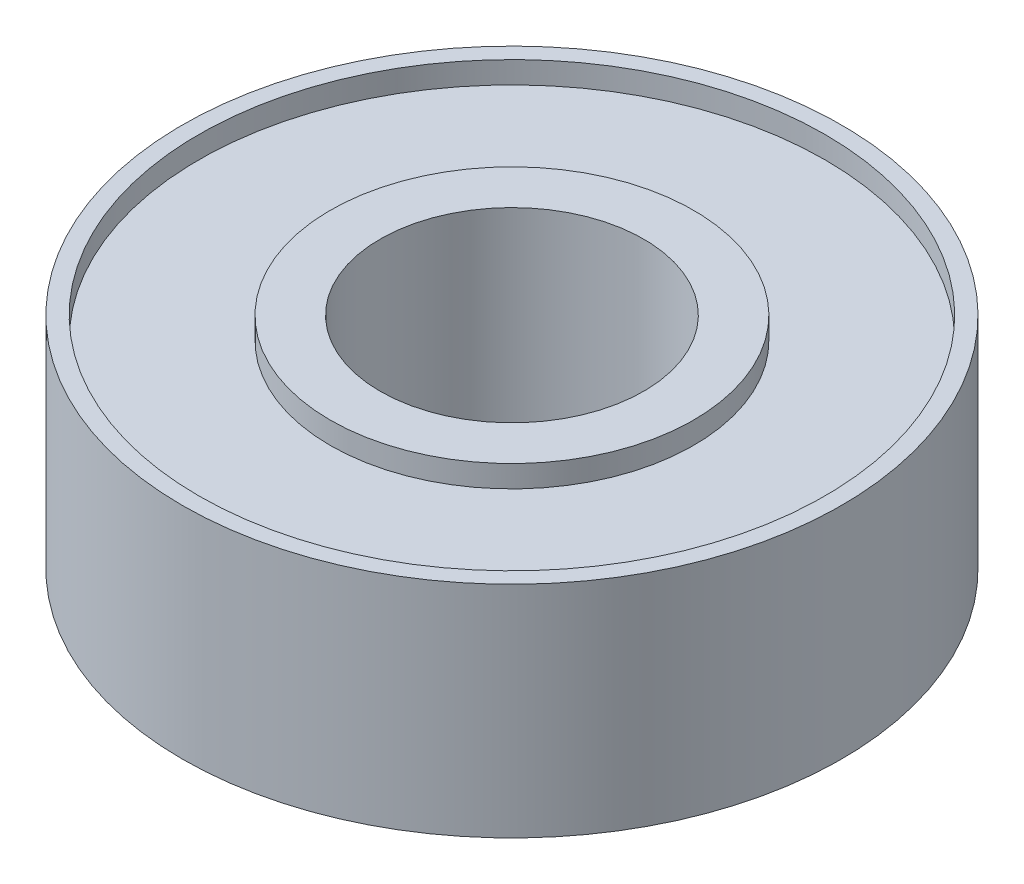
from build123d import *

# Parameters (mm, degrees)
CROQUIS1_R              = 7.5
CROQUIS1_R_2            = 3
SALIENTE_EXTRUIR1_DEPTH = 5
CROQUIS2_R              = 7.124900464
CROQUIS2_R_2            = 4.13518393
CORTAR_EXTRUIR1_DEPTH   = 0.5
CROQUIS3_R              = 6.927022016
CROQUIS3_R_2            = 3.541649153
CORTAR_EXTRUIR2_DEPTH   = 0.5


with BuildPart() as part:
    # Croquis1 → Saliente-Extruir1 (new body)
    with BuildSketch(Plane(origin=(0, 0, 0), x_dir=(1, 0, 0), z_dir=(0, 1, 0))):
        with Locations(Location((0, 0, 0), (0, 0, 270))):
            Circle(CROQUIS1_R)
        with Locations(Location((0, 0, 0), (0, 0, 270))):
            Circle(CROQUIS1_R_2, mode=Mode.SUBTRACT)
    extrude(amount=SALIENTE_EXTRUIR1_DEPTH)

    # Croquis2 → Cortar-Extruir1 (cut)
    with BuildSketch(Plane(origin=(0, 5, 0), x_dir=(1, 0, 0), z_dir=(0, 1, 0))):
        with Locations(Location((0, 0, 0), (0, 0, 270))):
            Circle(CROQUIS2_R)
        with Locations(Location((0, 0, 0), (0, 0, 270))):
            Circle(CROQUIS2_R_2, mode=Mode.SUBTRACT)
    extrude(amount=-CORTAR_EXTRUIR1_DEPTH, mode=Mode.SUBTRACT)

    # Croquis3 → Cortar-Extruir2 (cut)
    with BuildSketch(Plane.XZ):
        with Locations(Location((0, 0, 0), (0, 0, 270))):
            Circle(CROQUIS3_R)
        with Locations(Location((0, 0, 0), (0, 0, 270))):
            Circle(CROQUIS3_R_2, mode=Mode.SUBTRACT)
    extrude(amount=-CORTAR_EXTRUIR2_DEPTH, mode=Mode.SUBTRACT)


solid = part.part
